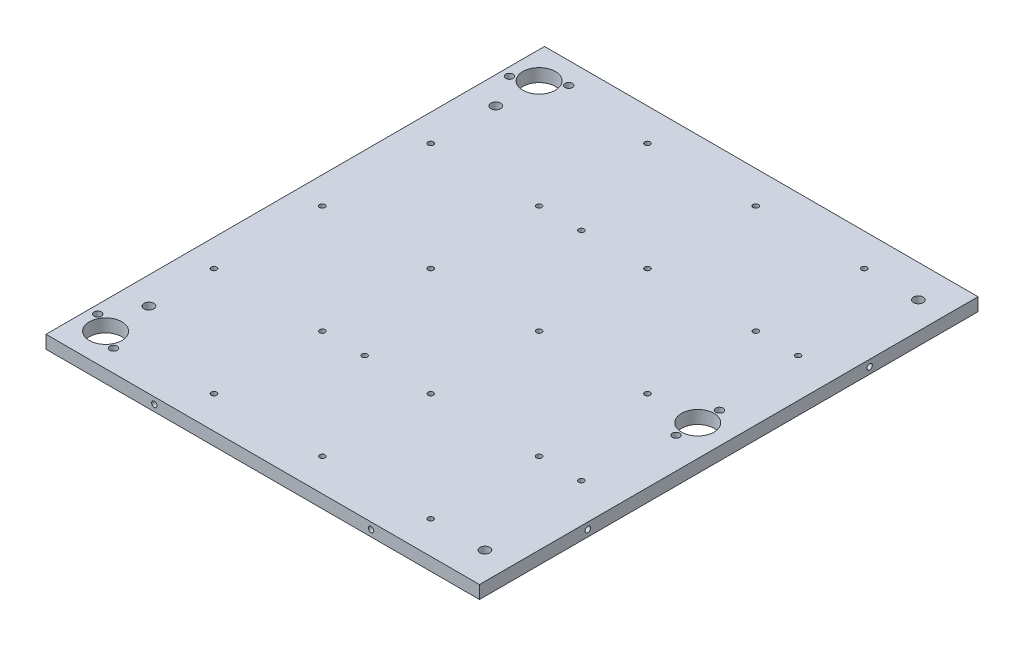
from build123d import *

# Parameters (mm, degrees)
SKIZZE1_W                          = 200
SKIZZE1_H                          = 230
AUFSATZ_LINEAR_AUSTRAGEN1_DEPTH    = 6
PILLAR_MOUNTING_A_D                = 3.4
PILLAR_GROMMET_D                   = 15
PILLAR_MOUNTING_B_D                = 3.4
M3_MOUNTING_GRID_D                 = 2.5
PEDESTAL_MOUNTING_HOLE_D           = 4.5
PEDESTAL_MOUNTING_HOLE_CSINK_D     = 8.96
PEDESTAL_MOUNTING_HOLE_CSINK_ANGLE = 90
SIDE_COVER_MOUNTING_THREAD_A_D     = 2.5
SIDE_COVER_MOUNTING_THREAD_A_DEPTH = 8.5
SIDE_COVER_MOUNTING_THREAD_A_TIP   = 0.751075774
SIDE_COVER_MOUNTING_THREAD_B_D     = 2.5
SIDE_COVER_MOUNTING_THREAD_B_DEPTH = 8.5
SIDE_COVER_MOUNTING_THREAD_B_TIP   = 0.751075774
SIDE_COVER_MOUNTING_THREAD_C_D     = 2.5
SIDE_COVER_MOUNTING_THREAD_C_DEPTH = 8.5
SIDE_COVER_MOUNTING_THREAD_C_TIP   = 0.751075774
SIDE_COVER_MOUNTING_THREAD_D_D     = 2.5
SIDE_COVER_MOUNTING_THREAD_D_DEPTH = 8.5
SIDE_COVER_MOUNTING_THREAD_D_TIP   = 0.751075774
MAINBOARD_MOUNTING_D               = 2.5
LINEARES_MUSTER1_COUNT             = 2
LINEARES_MUSTER1_PITCH             = 100
LINEARES_MUSTER1_COUNT_DIR2        = 2
LINEARES_MUSTER1_PITCH_DIR2        = 100


with BuildPart() as part:
    # Skizze1 → Aufsatz-Linear austragen1 (new body)
    with BuildSketch(Plane.XZ.offset(162)):
        with Locations((97.616977778, 94.226497308)):
            Rectangle(SKIZZE1_W, SKIZZE1_H)
    extrude(amount=-AUFSATZ_LINEAR_AUSTRAGEN1_DEPTH)

    # Pillar Mounting A (through all)
    with Locations(Plane(origin=(0, -162, 0), x_dir=(-1, 0, 0), z_dir=(0, -1, 0))):
        with Locations((-1.456723741, 0.773502692), (-18.777231816, 10.773502692)):
            Hole(PILLAR_MOUNTING_A_D / 2)

    # Pillar Grommet (through all)
    with Locations(Plane(origin=(0, -162, 0), x_dir=(-1, 0, 0), z_dir=(0, -1, 0))):
        with Locations((-10.116977778, 5.773502692), (-10.116977778, -194.226497308), (-183.322058535, -94.226497308)):
            Hole(PILLAR_GROMMET_D / 2)

    # Pillar Mounting B (through all)
    with Locations(Plane(origin=(0, -156, 0), x_dir=(1, 0, 0), z_dir=(0, 1, 0))):
        with Locations((183.322058535, -84.226497308), (18.777231816, -199.226497308), (1.456723741, -189.226497308), (183.322058535, -104.226497308)):
            Hole(PILLAR_MOUNTING_B_D / 2)

    # M3 Mounting Grid (through all)
    with Locations(Plane(origin=(0, -162, 0), x_dir=(-1, 0, 0), z_dir=(0, -1, 0))):
        with Locations((-60.116977778, -94.226497308), (-60.116977778, 5.773502692), (-60.116977778, -44.226497308), (-110.116977778, -44.226497308), (-110.116977778, -194.226497308), (-110.116977778, -94.226497308), (-110.116977778, 5.773502692), (-110.116977778, -144.226497308), (-60.116977778, -144.226497308), (-10.116977778, -144.226497308), (-10.116977778, -44.226497308), (-60.116977778, -194.226497308), (-160.116977778, -94.226497308), (-160.116977778, -44.226497308), (-160.116977778, -194.226497308), (-160.116977778, 5.773502692), (-160.116977778, -144.226497308), (-10.116977778, -94.226497308)):
            Hole(M3_MOUNTING_GRID_D / 2)

    # Pedestal Mounting Hole (through all)
    with Locations(Plane(origin=(0, -162, 0), x_dir=(-1, 0, 0), z_dir=(0, -1, 0))):
        with Locations((-10.116977535, -174.226497308), (-185.116977778, -194.226497308), (-185.116977778, 5.773502692), (-10.116977535, -14.226497308)):
            CounterSinkHole(PEDESTAL_MOUNTING_HOLE_D / 2, PEDESTAL_MOUNTING_HOLE_CSINK_D / 2, counter_sink_angle=PEDESTAL_MOUNTING_HOLE_CSINK_ANGLE)

    # Side Cover Mounting Thread A
    with Locations(Plane.XY.offset(209.226497308)):
        with Locations((47.616977778, -159), (147.616977778, -159)):
            Hole(SIDE_COVER_MOUNTING_THREAD_A_D / 2, depth=SIDE_COVER_MOUNTING_THREAD_A_DEPTH)
            with Locations((0, 0, -(SIDE_COVER_MOUNTING_THREAD_A_DEPTH + SIDE_COVER_MOUNTING_THREAD_A_TIP / 2))):  # 118° drill point
                Cone(0, SIDE_COVER_MOUNTING_THREAD_A_D / 2, SIDE_COVER_MOUNTING_THREAD_A_TIP, mode=Mode.SUBTRACT)

    # Side Cover Mounting Thread B
    with Locations(Plane(origin=(197.616977778, 0, 0), x_dir=(0, 0, -1), z_dir=(1, 0, 0))):
        with Locations((-29.226497308, -159), (-159.226497308, -159)):
            Hole(SIDE_COVER_MOUNTING_THREAD_B_D / 2, depth=SIDE_COVER_MOUNTING_THREAD_B_DEPTH)
            with Locations((0, 0, -(SIDE_COVER_MOUNTING_THREAD_B_DEPTH + SIDE_COVER_MOUNTING_THREAD_B_TIP / 2))):  # 118° drill point
                Cone(0, SIDE_COVER_MOUNTING_THREAD_B_D / 2, SIDE_COVER_MOUNTING_THREAD_B_TIP, mode=Mode.SUBTRACT)

    # Side Cover Mounting Thread  C
    with Locations(Plane(origin=(0, 0, -20.773502692), x_dir=(-1, 0, 0), z_dir=(0, 0, -1))):
        with Locations((-47.616977778, -159), (-147.616977778, -159)):
            Hole(SIDE_COVER_MOUNTING_THREAD_C_D / 2, depth=SIDE_COVER_MOUNTING_THREAD_C_DEPTH)
            with Locations((0, 0, -(SIDE_COVER_MOUNTING_THREAD_C_DEPTH + SIDE_COVER_MOUNTING_THREAD_C_TIP / 2))):  # 118° drill point
                Cone(0, SIDE_COVER_MOUNTING_THREAD_C_D / 2, SIDE_COVER_MOUNTING_THREAD_C_TIP, mode=Mode.SUBTRACT)

    # Side Cover Mounting Thread  D
    with Locations(Plane.ZY.offset(2.383022222)):
        with Locations((29.226497308, -159), (159.226497308, -159)):
            Hole(SIDE_COVER_MOUNTING_THREAD_D_D / 2, depth=SIDE_COVER_MOUNTING_THREAD_D_DEPTH)
            with Locations((0, 0, -(SIDE_COVER_MOUNTING_THREAD_D_DEPTH + SIDE_COVER_MOUNTING_THREAD_D_TIP / 2))):  # 118° drill point
                Cone(0, SIDE_COVER_MOUNTING_THREAD_D_D / 2, SIDE_COVER_MOUNTING_THREAD_D_TIP, mode=Mode.SUBTRACT)

    # Mainboard Mounting (through all)
    with Locations(Plane(origin=(0, -162, 0), x_dir=(-1, 0, 0), z_dir=(0, -1, 0))):
        with Locations((-179.616977778, -144.226497308)):
            mainboard_mounting = Hole(MAINBOARD_MOUNTING_D / 2)

    # Lineares Muster1: Mainboard Mounting 2 × 2
    with Locations(*[(-i * LINEARES_MUSTER1_PITCH, 0, -j * LINEARES_MUSTER1_PITCH_DIR2) for i in range(LINEARES_MUSTER1_COUNT) for j in range(LINEARES_MUSTER1_COUNT_DIR2) if (i, j) != (0, 0)]):
        add(mainboard_mounting, mode=Mode.SUBTRACT)


solid = part.part
